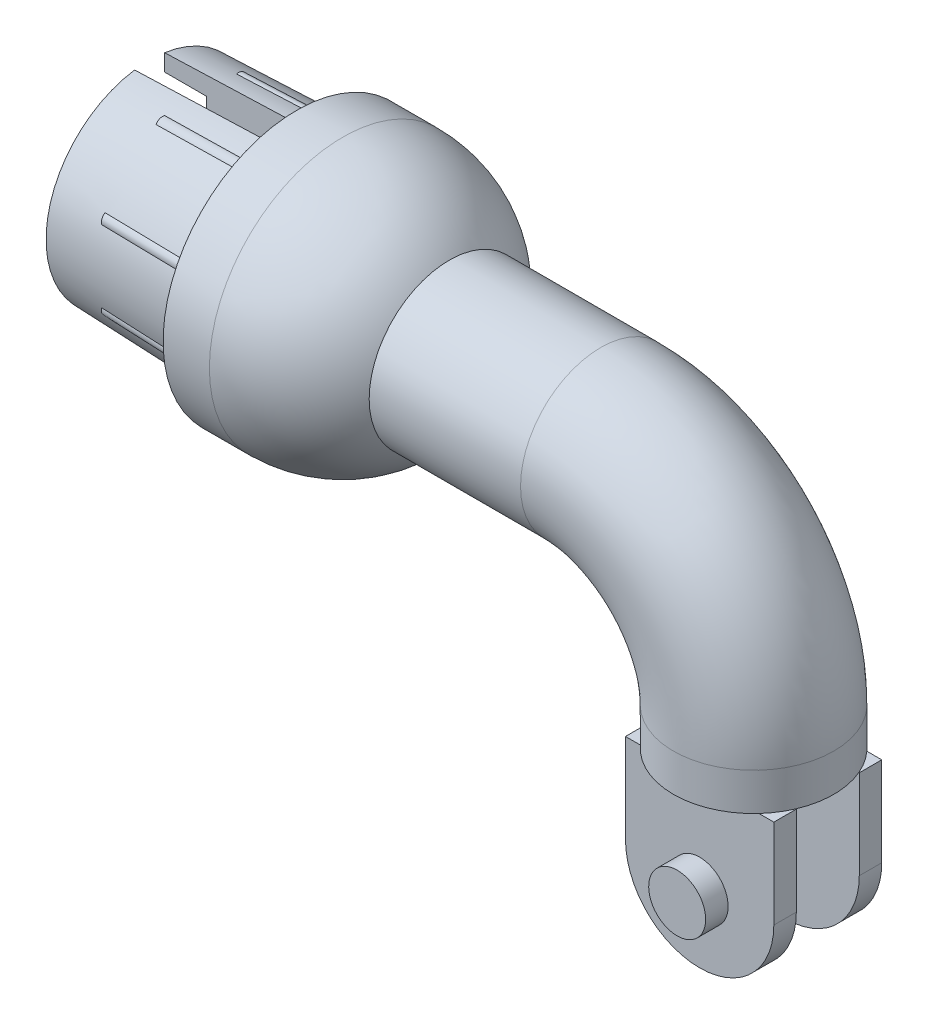
from build123d import *

# Parameters (mm, degrees)
SKETCH1_R           = 5.35
SKETCH4_R           = 7.25
BOSS_EXTRUDE1_DEPTH = 9.8
BOSS_EXTRUDE1_TAPER = 2
SHELL1_T            = -2
SKETCH7_R           = 0.5
CIRPATTERN1_COUNT   = 8
SKETCH8_R           = 5.8
CUT_EXTRUDE1_DEPTH  = 2.8
SKETCH9_W           = 9.16
SKETCH9_H           = 2
CUT_EXTRUDE2_DEPTH  = 50.87283838
BOSS_EXTRUDE2_DEPTH = 1.5
SKETCH11_R          = 1.9
BOSS_EXTRUDE3_DEPTH = 1.5


with BuildPart() as part:
    # Base-Sweep: sweep along a path in Sketch2
    with BuildLine(Plane.XY) as base_sweep_path:
        Line((0, 6.4), (0, 8.9))
        ThreePointArc((0, 8.9), (-2.987510832, 16.112489168), (-10.2, 19.1))
        Line((-10.2, 19.1), (-25.4, 19.1))
    # Sketch1 → Base-Sweep (sweep)
    with BuildSketch(Plane(origin=(0, 6.4, 0), x_dir=(-1, 0, 0), z_dir=(0, 1, 0))):
        Circle(SKETCH1_R)
    sweep(path=base_sweep_path.line)

    # Sketch3 → Boss-Revolve1 (revolve)
    with BuildSketch(Plane.XY, mode=Mode.PRIVATE) as boss_revolve1_sk:
        with BuildLine():
            Line((-27.412489016, 28), (-30.5, 28))
            Line((-30.5, 28), (-30.5, 19.1))
            Line((-30.5, 19.1), (-18.512489016, 19.1))
            ThreePointArc((-18.512489016, 19.1), (-21.119238663, 25.393250353), (-27.412489016, 28))
        make_face()
    revolve(boss_revolve1_sk.sketch.rotate(Axis((-36.172167942, 19.1, 0), (-1, 0, 0)), 270), axis=Axis((-36.172167942, 19.1, 0), (-1, 0, 0)))

    # Sketch4 → Boss-Extrude1 (add)
    with BuildSketch(Plane.ZY.offset(30.5)):
        with Locations((0, 19.1)):
            Circle(SKETCH4_R)
    extrude(amount=BOSS_EXTRUDE1_DEPTH, taper=BOSS_EXTRUDE1_TAPER)

    # Shell1
    shell1_openings = [part.faces().sort_by_distance(p)[0] for p in [
        (-40.3, 19.1, 0),
        (0, 6.4, 0),
    ]]
    offset(amount=SHELL1_T, openings=shell1_openings, kind=Kind.INTERSECTION)

    # Boss-Sweep1: sweep along a path in Sketch6
    with BuildLine(Plane(origin=(0, 2.79713024, 6.75286976), x_dir=(1, 0, 0), z_dir=(0, 0.38268343236509056, 0.9238795325112865))) as boss_sweep1_path:
        Line((-36.9, 24.672606146), (-30.5, 24.896099071))
    # Sketch7 → Boss-Sweep1 (sweep)
    with BuildSketch(Plane.ZY.offset(30.5)):
        with Locations((-2.621381512, 25.428574798)):
            Circle(SKETCH7_R)
    boss_sweep1 = sweep(path=boss_sweep1_path.line)

    # CirPattern1: Boss-Sweep1 ×8 about axis
    cirpattern1_axis = Axis((-36.172167942, 19.1, 0), (-1, 0, 0))
    for i in range(1, CIRPATTERN1_COUNT):
        add(boss_sweep1.rotate(cirpattern1_axis, i * 360 / CIRPATTERN1_COUNT))

    # Sketch8 → Cut-Extrude1 (cut)
    with BuildSketch(Plane.ZY.offset(40.3)):
        with Locations(Location((0, 19.1, 0), (0, 0, 270))):
            Circle(SKETCH8_R)
    extrude(amount=-CUT_EXTRUDE1_DEPTH, mode=Mode.SUBTRACT)

    # Sketch9 → Cut-Extrude2 (cut, through all)
    with BuildSketch(Plane(origin=(0, 0, 0), x_dir=(1, 0, 0), z_dir=(0, 1, 0))):
        with Locations((-35.72, 0)):
            Rectangle(SKETCH9_W, SKETCH9_H)
    extrude(amount=CUT_EXTRUDE2_DEPTH, mode=Mode.SUBTRACT)

    # Sketch10 → Boss-Extrude2 (add)
    with BuildSketch(Plane(origin=(0, 12.319, -3.6), x_dir=(1, 0, 0), z_dir=(0, 0, -1))):
        with BuildLine():
            Line((-4.95, 5.919), (4.95, 5.919))
            Line((4.95, 5.919), (4.95, 11.869))
            ThreePointArc((4.95, 11.869), (0, 16.819), (-4.95, 11.869))
            Line((-4.95, 11.869), (-4.95, 5.919))
        make_face()
    boss_extrude2 = extrude(amount=-BOSS_EXTRUDE2_DEPTH)

    # Sketch11 → Boss-Extrude3 (add)
    with BuildSketch(Plane(origin=(0, 0, -3.6), x_dir=(-1, 0, 0), z_dir=(0, 0, -1))):
        with Locations(Location((0, 0, 0), (0, 0, 180))):
            Circle(SKETCH11_R)
    boss_extrude3 = extrude(amount=BOSS_EXTRUDE3_DEPTH)

    # Mirror1: Boss-Extrude2, Boss-Extrude3 across plane
    add(boss_extrude2.mirror(Plane.XY))
    add(boss_extrude3.mirror(Plane.XY))


solid = part.part
